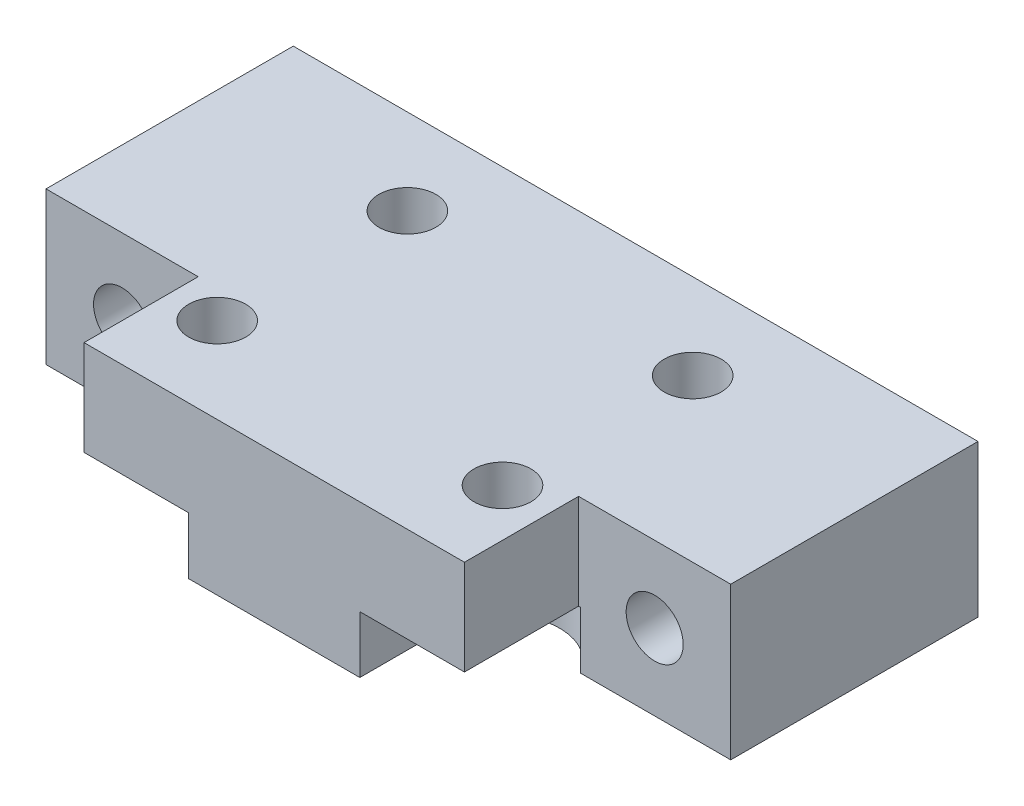
from build123d import *

# Parameters (mm, degrees)
SKETCH_1_R          = 1.5
EXTRUDE_1_DEPTH     = 8
SKETCH_2_R          = 1.5
CUT_EXTRUDE_1_DEPTH = 28.367864367
SKETCH_3_R          = 3
CUT_EXTRUDE_2_DEPTH = 3
CUT_EXTRUDE_3_DEPTH = 3


with BuildPart() as part:
    # 草图1 → 凸台-拉伸1 (new body)
    with BuildSketch(Plane(origin=(0, 0, 0), x_dir=(1, 0, 0), z_dir=(0, 1, 0))):
        Polygon((-18, 19), (18, 19), (18, 6), (10, 6), (10, 0), (-10, 0), (-10, 6), (-18, 6), align=None)
        with Locations(Location((7.5, 14.5, 0), (0, 0, 270))):
            Circle(SKETCH_1_R, mode=Mode.SUBTRACT)
        with Locations(Location((7.5, 4.5, 0), (0, 0, 90))):
            Circle(SKETCH_1_R, mode=Mode.SUBTRACT)
        with Locations(Location((-7.5, 4.5, 0), (0, 0, 270))):
            Circle(SKETCH_1_R, mode=Mode.SUBTRACT)
        with Locations(Location((-7.5, 14.5, 0), (0, 0, 90))):
            Circle(SKETCH_1_R, mode=Mode.SUBTRACT)
    extrude(amount=EXTRUDE_1_DEPTH)

    # 草图2 → 切除-拉伸1 (cut, through all)
    with BuildSketch(Plane(origin=(0, 0, -19), x_dir=(-1, 0, 0), z_dir=(0, 0, -1))):
        with Locations((-14, 4)):
            Circle(SKETCH_2_R)
        with Locations((14, 4)):
            Circle(SKETCH_2_R)
    extrude(amount=-CUT_EXTRUDE_1_DEPTH, mode=Mode.SUBTRACT)

    # 草图3 → 切除-拉伸2 (cut)
    with BuildSketch(Plane.XZ):
        with Locations(Location((-7.5, -14.5, 0), (0, 0, 270))):
            Circle(SKETCH_3_R)
        with Locations(Location((7.5, -14.5, 0), (0, 0, 270))):
            Circle(SKETCH_3_R)
    extrude(amount=-CUT_EXTRUDE_2_DEPTH, mode=Mode.SUBTRACT)

    # 草图4 → 切除-拉伸3 (cut)
    with BuildSketch(Plane.XZ):
        with BuildLine():
            ThreePointArc((-10, -2.841687605), (-6.633974596, -1.627718677), (-4.5, -4.5))
            Line((-4.5, -4.5), (-4.5, 0))
            Line((-4.5, 0), (-10, 0))
            Line((-10, 0), (-10, -2.841687605))
        make_face()
        with BuildLine():
            Line((-6, -4.5), (-4.5, -4.5))
            ThreePointArc((-4.5, -4.5), (-6.633974596, -1.627718677), (-10, -2.841687605))
            Line((-10, -2.841687605), (-10, -4.5))
            Line((-10, -4.5), (-9, -4.5))
            ThreePointArc((-9, -4.5), (-7.5, -3), (-6, -4.5))
        make_face()
        with BuildLine():
            ThreePointArc((-10.098076211, -6), (-6.723542865, -7.397777479), (-4.5, -4.5))
            Line((-4.5, -4.5), (-6, -4.5))
            ThreePointArc((-6, -4.5), (-7.5, -6), (-9, -4.5))
            Line((-9, -4.5), (-10, -4.5))
            Line((-10, -4.5), (-10, -6))
            Line((-10, -6), (-10.098076211, -6))
        make_face()
        with BuildLine():
            ThreePointArc((10, -2.841687605), (6.633974596, -1.627718677), (4.5, -4.5))
            Line((4.5, -4.5), (6, -4.5))
            ThreePointArc((6, -4.5), (7.5, -3), (9, -4.5))
            Line((9, -4.5), (10, -4.5))
            Line((10, -4.5), (10, -2.841687605))
        make_face()
        with BuildLine():
            Line((6, -4.5), (4.5, -4.5))
            ThreePointArc((4.5, -4.5), (6.723542865, -7.397777479), (10.098076211, -6))
            Line((10.098076211, -6), (10, -6))
            Line((10, -6), (10, -4.5))
            Line((10, -4.5), (9, -4.5))
            ThreePointArc((9, -4.5), (7.5, -6), (6, -4.5))
        make_face()
        with BuildLine():
            Line((10, 0), (4.5, 0))
            Line((4.5, 0), (4.5, -4.5))
            ThreePointArc((4.5, -4.5), (6.633974596, -1.627718677), (10, -2.841687605))
            Line((10, -2.841687605), (10, 0))
        make_face()
    extrude(amount=-CUT_EXTRUDE_3_DEPTH, mode=Mode.SUBTRACT)


solid = part.part
